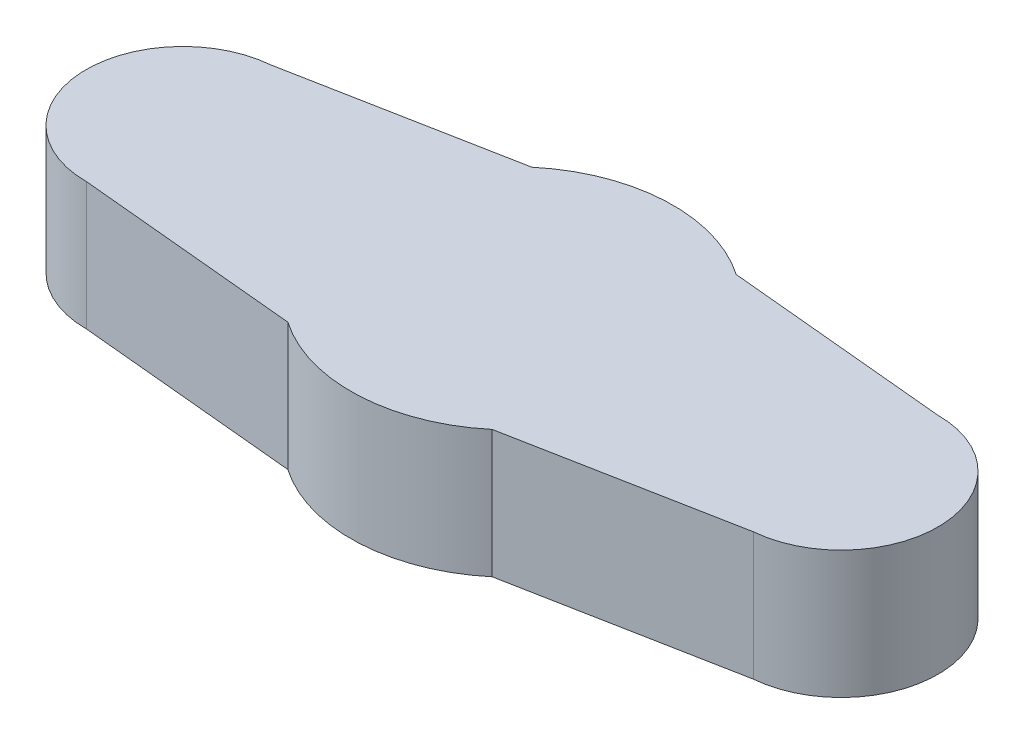
from build123d import *

# Parameters (mm, degrees)
SKETCH1_R           = 2.032
BOSS_EXTRUDE1_DEPTH = 2.159
BOSS_EXTRUDE2_START = -2.54
BOSS_EXTRUDE2_DEPTH = 2.54
BOSS_EXTRUDE3_START = 2.159
BOSS_EXTRUDE3_DEPTH = 2


with BuildPart() as part:
    # Sketch1 → Boss-Extrude1 (new body)
    with BuildSketch(Plane(origin=(0, 19.05, 0), x_dir=(1, 0, 0), z_dir=(0, 1, 0))):
        with BuildLine():
            Line((27.891662372, 5.862371385), (16.22825993, 6.965475496))
            ThreePointArc((16.22825993, 6.965475496), (11.029140385, 8.448695687), (5.993806888, 6.479888246))
            Line((5.993806888, 6.479888246), (-5.512759891, 4.277454099))
            ThreePointArc((-5.512759891, 4.277454099), (-10.135739741, -1.023215233), (-5.031662372, -5.862371385))
            Line((-5.031662372, -5.862371385), (6.63174007, -6.965475496))
            ThreePointArc((6.63174007, -6.965475496), (11.830859615, -8.448695687), (16.866193112, -6.479888246))
            Line((16.866193112, -6.479888246), (28.372759891, -4.277454099))
            ThreePointArc((28.372759891, -4.277454099), (32.995739741, 1.023215233), (27.891662372, 5.862371385))
        make_face()
        with Locations(Location((11.43, 0, 0), (0, 0, 270))):
            Circle(SKETCH1_R, mode=Mode.SUBTRACT)
    extrude(amount=BOSS_EXTRUDE1_DEPTH)

    # Sketch1<3> → Boss-Extrude2 (add)
    with BuildSketch(Plane(origin=(0, 19.05, 0), x_dir=(1, 0, 0), z_dir=(0, 1, 0)).offset(BOSS_EXTRUDE2_START)):
        with BuildLine():
            Line((5.993806888, 6.479888246), (-5.512759891, 4.277454099))
            ThreePointArc((-5.512759891, 4.277454099), (-10.135739741, -1.023215233), (-5.031662372, -5.862371385))
            Line((-5.031662372, -5.862371385), (6.63174007, -6.965475496))
            ThreePointArc((6.63174007, -6.965475496), (11.830859615, -8.448695687), (16.866193112, -6.479888246))
            Line((16.866193112, -6.479888246), (28.372759891, -4.277454099))
            ThreePointArc((28.372759891, -4.277454099), (32.995739741, 1.023215233), (27.891662372, 5.862371385))
            Line((27.891662372, 5.862371385), (16.22825993, 6.965475496))
            ThreePointArc((16.22825993, 6.965475496), (11.029140385, 8.448695687), (5.993806888, 6.479888246))
        make_face()
        with BuildLine():
            ThreePointArc((28.0418263, -1.754687144), (30.458593889, 0.90283697), (27.801069775, 3.319604559))
            Line((27.801069775, 3.319604559), (15.268026397, 4.504957782))
            ThreePointArc((15.268026397, 4.504957782), (11.149518648, 5.911549835), (7.18268751, 4.121338114))
            Line((7.18268751, 4.121338114), (-5.1818263, 1.754687144))
            ThreePointArc((-5.1818263, 1.754687144), (-7.598593889, -0.90283697), (-4.941069775, -3.319604559))
            Line((-4.941069775, -3.319604559), (7.591973603, -4.504957782))
            ThreePointArc((7.591973603, -4.504957782), (11.710481352, -5.911549835), (15.67731249, -4.121338114))
            Line((15.67731249, -4.121338114), (28.0418263, -1.754687144))
        make_face(mode=Mode.SUBTRACT)
    extrude(amount=BOSS_EXTRUDE2_DEPTH)

    # Sketch1<4> → Boss-Extrude3 (add)
    with BuildSketch(Plane(origin=(0, 19.05, 0), x_dir=(1, 0, 0), z_dir=(0, 1, 0)).offset(BOSS_EXTRUDE3_START)):
        with BuildLine():
            Line((27.891662372, 5.862371385), (16.22825993, 6.965475496))
            ThreePointArc((16.22825993, 6.965475496), (11.029140385, 8.448695687), (5.993806888, 6.479888246))
            Line((5.993806888, 6.479888246), (-5.512759891, 4.277454099))
            ThreePointArc((-5.512759891, 4.277454099), (-10.135739741, -1.023215233), (-5.031662372, -5.862371385))
            Line((-5.031662372, -5.862371385), (6.63174007, -6.965475496))
            ThreePointArc((6.63174007, -6.965475496), (11.830859615, -8.448695687), (16.866193112, -6.479888246))
            Line((16.866193112, -6.479888246), (28.372759891, -4.277454099))
            ThreePointArc((28.372759891, -4.277454099), (32.995739741, 1.023215233), (27.891662372, 5.862371385))
        make_face()
    extrude(amount=BOSS_EXTRUDE3_DEPTH)


solid = part.part
